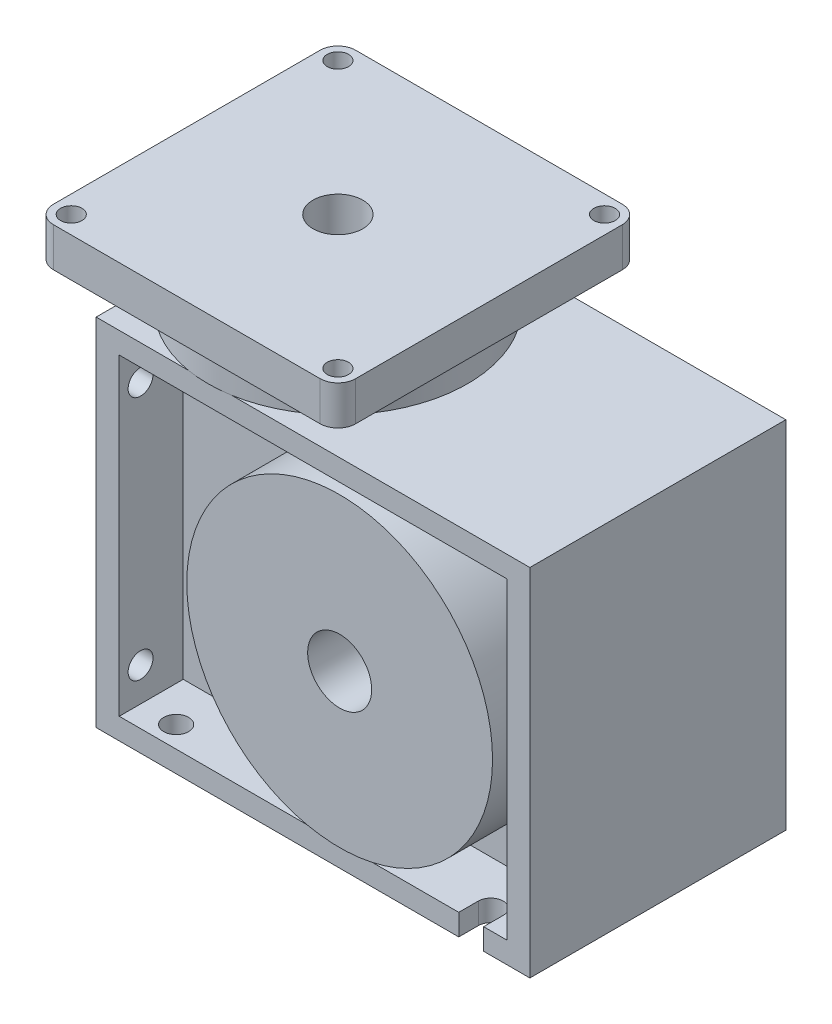
from build123d import *

# Parameters (mm, degrees)
CROQUIS2_W              = 122
CROQUIS2_H              = 72
SALIENTE_EXTRUIR1_DEPTH = 100
CROQUIS3_W              = 109
CROQUIS3_H              = 88
CORTAR_EXTRUIR1_DEPTH   = 18
CROQUIS4_W              = 109
CROQUIS4_H              = 88
CORTAR_EXTRUIR2_DEPTH   = 18
SALIENTE_EXTRUIR2_DEPTH = 12
CROQUIS6_W              = 85
CROQUIS6_H              = 85
SALIENTE_EXTRUIR3_DEPTH = 11
CROQUIS7_R              = 43
SALIENTE_EXTRUIR7_DEPTH = 20
SALIENTE_EXTRUIR8_START = 20
CROQUIS8_R              = 43
SALIENTE_EXTRUIR8_DEPTH = 20
CROQUIS9_R              = 9
CORTAR_EXTRUIR3_DEPTH   = 76
CROQUIS10_R             = 3.5
CORTAR_EXTRUIR5_DEPTH   = 6
CROQUIS11_R             = 3.5
CORTAR_EXTRUIR6_DEPTH   = 6.5
CROQUIS12_R             = 7
CORTAR_EXTRUIR7_DEPTH   = 36
CROQUIS13_R             = 3
CORTAR_EXTRUIR8_DEPTH   = 11
REDONDEO2_R             = 5


with BuildPart() as part:
    # Croquis2 → Saliente-Extruir1 (new body)
    with BuildSketch(Plane(origin=(0, 0, 0), x_dir=(1, 0, 0), z_dir=(0, 1, 0))):
        Rectangle(CROQUIS2_W, CROQUIS2_H)
    extrude(amount=SALIENTE_EXTRUIR1_DEPTH)

    # Croquis3 → Cortar-Extruir1 (cut)
    with BuildSketch(Plane(origin=(0, 0, -36), x_dir=(-1, 0, 0), z_dir=(0, 0, -1))):
        with Locations((0, 50)):
            Rectangle(CROQUIS3_W, CROQUIS3_H)
    extrude(amount=-CORTAR_EXTRUIR1_DEPTH, mode=Mode.SUBTRACT)

    # Croquis4 → Cortar-Extruir2 (cut)
    with BuildSketch(Plane.XY.offset(36)):
        with Locations((0, 50)):
            Rectangle(CROQUIS4_W, CROQUIS4_H)
    extrude(amount=-CORTAR_EXTRUIR2_DEPTH, mode=Mode.SUBTRACT)

    # Croquis5 → Saliente-Extruir2 (add)
    with BuildSketch(Plane(origin=(0, 100, 0), x_dir=(1, 0, 0), z_dir=(0, 1, 0))):
        with BuildLine():
            Line((-61, 17.557049866), (-61, 0))
            Line((-61, 0), (-29, 0))
            Line((-29, 0), (7.5, 0))
            ThreePointArc((7.5, 0), (-1.143141768, 23.584856359), (-22.979202711, 36))
            Line((-22.979202711, 36), (-35.020797289, 36))
            ThreePointArc((-35.020797289, 36), (-50.128910503, 29.762713938), (-61, 17.557049866))
        make_face()
        with BuildLine():
            Line((-61, -17.557049866), (-61, 0))
            Line((-61, 0), (-61, 17.557049866))
            ThreePointArc((-61, 17.557049866), (-65.5, 0), (-61, -17.557049866))
        make_face()
        with BuildLine():
            Line((-29, 0), (-61, 0))
            Line((-61, 0), (-61, -17.557049866))
            ThreePointArc((-61, -17.557049866), (-50.128910503, -29.762713938), (-35.020797289, -36))
            Line((-35.020797289, -36), (-22.979202711, -36))
            ThreePointArc((-22.979202711, -36), (-1.143141768, -23.584856359), (7.5, 0))
            Line((7.5, 0), (-29, 0))
        make_face()
        with BuildLine():
            Line((-22.979202711, -36), (-35.020797289, -36))
            ThreePointArc((-35.020797289, -36), (-29, -36.5), (-22.979202711, -36))
        make_face()
        with BuildLine():
            ThreePointArc((-22.979202711, 36), (-29, 36.5), (-35.020797289, 36))
            Line((-35.020797289, 36), (-22.979202711, 36))
        make_face()
    extrude(amount=SALIENTE_EXTRUIR2_DEPTH)

    # Croquis6 → Saliente-Extruir3 (add)
    with BuildSketch(Plane(origin=(0, 112, 0), x_dir=(1, 0, 0), z_dir=(0, 1, 0))):
        with Locations((-29, 0)):
            Rectangle(CROQUIS6_W, CROQUIS6_H)
    extrude(amount=SALIENTE_EXTRUIR3_DEPTH)

    # Croquis7 → Saliente-Extruir7 (add)
    with BuildSketch(Plane.XY.offset(18)):
        with Locations(Location((9.5, 50, 0), (0, 0, 180))):
            Circle(CROQUIS7_R)
    extrude(amount=SALIENTE_EXTRUIR7_DEPTH)

    # Croquis8 → Saliente-Extruir8 (add)
    with BuildSketch(Plane(origin=(0, 0, -18), x_dir=(-1, 0, 0), z_dir=(0, 0, -1)).offset(SALIENTE_EXTRUIR8_START)):
        with Locations((-9.5, 50)):
            Circle(CROQUIS8_R)
    extrude(amount=-SALIENTE_EXTRUIR8_DEPTH)

    # Croquis9 → Cortar-Extruir3 (cut)
    with BuildSketch(Plane.XY.offset(38)):
        with Locations((9.5, 50)):
            Circle(CROQUIS9_R)
    extrude(amount=-CORTAR_EXTRUIR3_DEPTH, mode=Mode.SUBTRACT)

    # Croquis10 → Cortar-Extruir5 (cut)
    with BuildSketch(Plane.XZ):
        with BuildLine():
            Line((48, 36), (41, 36))
            Line((41, 36), (41, 30.5))
            ThreePointArc((41, 30.5), (44.5, 27), (48, 30.5))
            Line((48, 30.5), (48, 36))
        make_face()
        with BuildLine():
            Line((41, -30.5), (41, -36))
            Line((41, -36), (48, -36))
            Line((48, -36), (48, -30.5))
            ThreePointArc((48, -30.5), (44.5, -27), (41, -30.5))
        make_face()
        with Locations(Location((-44.5, -30, 0), (0, 0, 270))):
            Circle(CROQUIS10_R)
        with Locations(Location((-44.5, 30, 0), (0, 0, 270))):
            Circle(CROQUIS10_R)
    extrude(amount=-CORTAR_EXTRUIR5_DEPTH, mode=Mode.SUBTRACT)

    # Croquis11 → Cortar-Extruir6 (cut)
    with BuildSketch(Plane.ZY.offset(61)):
        with Locations((-30, 84.5)):
            Circle(CROQUIS11_R)
        with Locations((30, 84.5)):
            Circle(CROQUIS11_R)
        with Locations((-30, 15.5)):
            Circle(CROQUIS11_R)
        with Locations((30, 15.5)):
            Circle(CROQUIS11_R)
    extrude(amount=-CORTAR_EXTRUIR6_DEPTH, mode=Mode.SUBTRACT)

    # Croquis12 → Cortar-Extruir7 (cut)
    with BuildSketch(Plane(origin=(0, 123, 0), x_dir=(1, 0, 0), z_dir=(0, 1, 0))):
        with Locations(Location((-29, 0, 0), (0, 0, 270))):
            Circle(CROQUIS12_R)
    extrude(amount=-CORTAR_EXTRUIR7_DEPTH, mode=Mode.SUBTRACT)

    # Croquis13 → Cortar-Extruir8 (cut)
    with BuildSketch(Plane(origin=(0, 123, 0), x_dir=(1, 0, 0), z_dir=(0, 1, 0))):
        with Locations(Location((-66.5, 37.5, 0), (0, 0, 270))):
            Circle(CROQUIS13_R)
        with Locations(Location((8.5, 37.5, 0), (0, 0, 270))):
            Circle(CROQUIS13_R)
        with Locations(Location((-66.5, -37.5, 0), (0, 0, 270))):
            Circle(CROQUIS13_R)
        with Locations(Location((8.5, -37.5, 0), (0, 0, 270))):
            Circle(CROQUIS13_R)
    extrude(amount=-CORTAR_EXTRUIR8_DEPTH, mode=Mode.SUBTRACT)

    # Redondeo2
    redondeo2_edges = [part.edges().sort_by_distance(p)[0] for p in [
        (13.5, 117.5, 42.5),
        (13.5, 117.5, -42.5),
        (-71.5, 117.5, -42.5),
        (-71.5, 117.5, 42.5),
    ]]
    fillet(redondeo2_edges, radius=REDONDEO2_R)


solid = part.part
